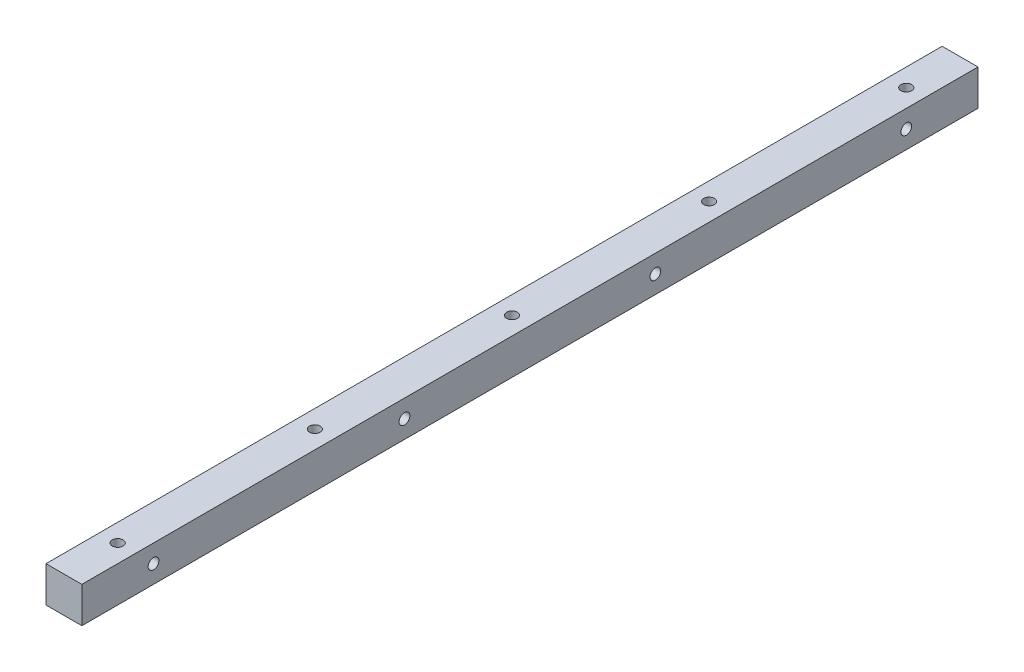
from build123d import *

# Parameters (mm, degrees)
SKETCH1_W          = 10
SKETCH1_H          = 10
EXTRUDE1_DEPTH     = 250
SKETCH4_R          = 1.5
CUT_EXTRUDE3_DEPTH = 251.399680511
LPATTERN2_COUNT    = 5
LPATTERN2_PITCH    = 55
SKETCH5_R          = 1.5
CUT_EXTRUDE4_DEPTH = 251.399680511


with BuildPart() as part:
    # Sketch1 → Extrude1 (new body)
    with BuildSketch(Plane.XY):
        with Locations((5, 5)):
            Rectangle(SKETCH1_W, SKETCH1_H)
    extrude(amount=EXTRUDE1_DEPTH)

    # Sketch4 → Cut-Extrude3 (cut, through all)
    with BuildSketch(Plane(origin=(0, 10, 0), x_dir=(-1, 0, 0), z_dir=(0, 1, 0))):
        with Locations(Location((-5, 15, 0), (0, 0, 90))):
            Circle(SKETCH4_R)
    cut_extrude3 = extrude(amount=-CUT_EXTRUDE3_DEPTH, mode=Mode.SUBTRACT)

    # LPattern2: Cut-Extrude3 ×5
    with Locations(*[(0, 0, i * LPATTERN2_PITCH) for i in range(1, LPATTERN2_COUNT)]):
        add(cut_extrude3, mode=Mode.SUBTRACT)

    # Sketch5 → Cut-Extrude4 (cut, through all)
    with BuildSketch(Plane.ZY):
        with Locations((20, 5)):
            Circle(SKETCH5_R)
        with Locations((90, 5)):
            Circle(SKETCH5_R)
        with Locations((230, 5)):
            Circle(SKETCH5_R)
        with Locations((160, 5)):
            Circle(SKETCH5_R)
    extrude(amount=-CUT_EXTRUDE4_DEPTH, mode=Mode.SUBTRACT)


solid = part.part
